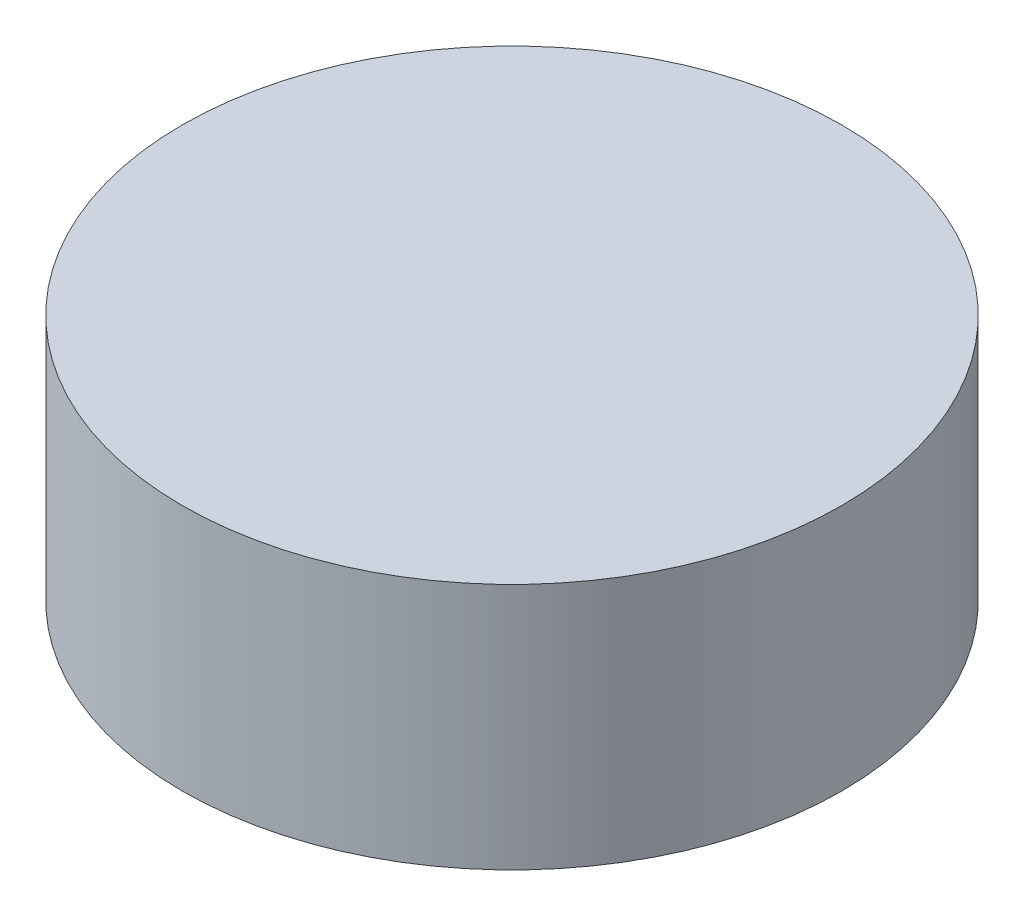
from build123d import *

# Parameters (mm, degrees)
SKETCH1_R           = 40
SKETCH1_R_2         = 34
BOSS_EXTRUDE1_DEPTH = 30


with BuildPart() as part:
    # Sketch1 → Boss-Extrude1 (new body)
    with BuildSketch(Plane.XZ.offset(270)):
        with Locations((-70, 999.189515243)):
            Circle(SKETCH1_R)
        with Locations((-70, 999.189515243)):
            Circle(SKETCH1_R_2, mode=Mode.SUBTRACT)
    extrude(amount=BOSS_EXTRUDE1_DEPTH)

    # Sketch3 → Revolve1 (revolve)
    with BuildSketch(Plane.XY.offset(999.189515243)):
        with BuildLine():
            Line((-104, -298.619095925), (-104, -270))
            Line((-104, -270), (-70, -270))
            Line((-70, -270), (-70, -304))
            ThreePointArc((-70, -304), (-87.211581338, -302.646454438), (-104, -298.619095925))
        make_face()
    revolve(axis=Axis((-70, -270, 999.189515243), (0, -1, 0)))


solid = part.part
